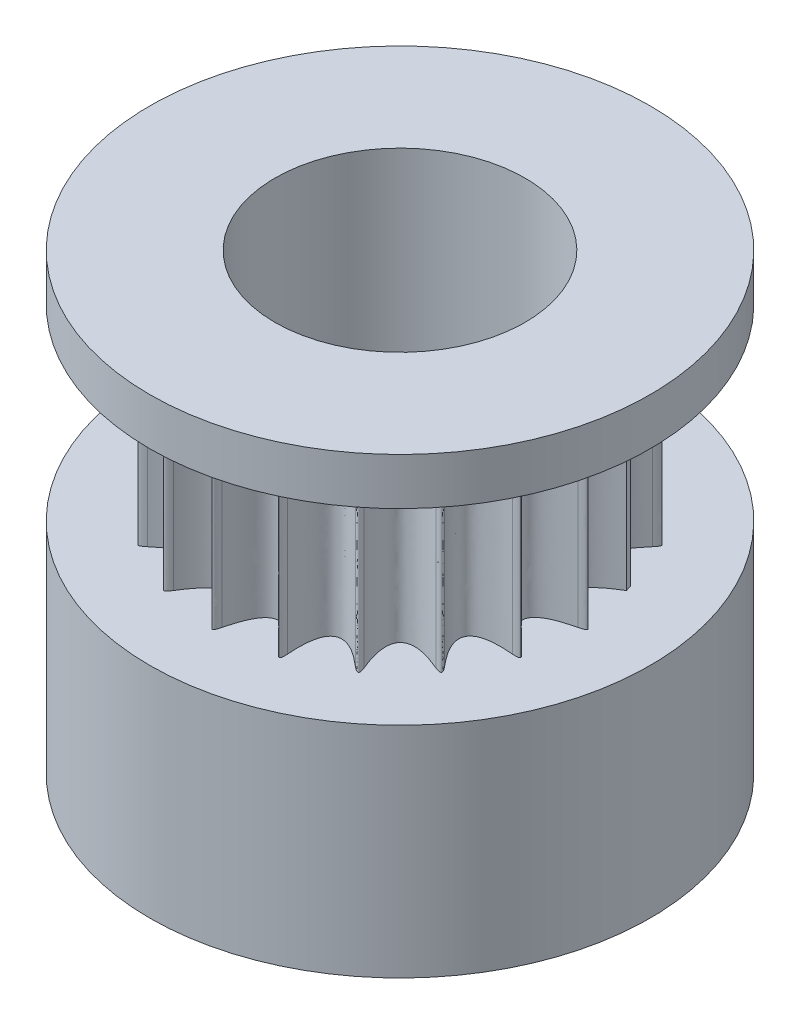
from build123d import *

# Parameters (mm, degrees)
SKETCH1_R           = 8
BOSS_EXTRUDE1_DEPTH = 7
BOSS_EXTRUDE2_DEPTH = 6
SKETCH3_R           = 8
BOSS_EXTRUDE3_DEPTH = 1.5
SKETCH4_R           = 4
CUT_EXTRUDE1_DEPTH  = 19.391574245


with BuildPart() as part:
    # Sketch1 → Boss-Extrude1 (new body)
    with BuildSketch(Plane(origin=(0, 0, 0), x_dir=(1, 0, 0), z_dir=(0, 1, 0))):
        with Locations(Location((0, 0, 0), (0, 0, 270))):
            Circle(SKETCH1_R)
    extrude(amount=BOSS_EXTRUDE1_DEPTH)

    # Sketch2 → Boss-Extrude2 (add)
    with BuildSketch(Plane(origin=(0, 7, 0), x_dir=(1, 0, 0), z_dir=(0, 1, 0))):
        with BuildLine():
            Line((5.547029494, 1.697192916), (5.516127795, 1.792298567))
            Line((5.516127795, 1.792298567), (5.485226095, 1.887404219))
            add(Edge.make_bspline(
                [(4.751077093, 3.328252764), (3.353389557, 1.729025513), (5.485226095, 1.887404219)],
                knots=[0, 0, 0, 1, 1, 1], degree=2))
            add(Edge.make_bspline(
                [(4.854101972, 3.526711505), (4.883491215, 3.486260648), (4.751077093, 3.328252764)],
                knots=[0.500000051, 0.500000051, 0.500000051, 1, 1, 1], degree=2))
            add(Edge.make_bspline(
                [(4.633520042, 3.490056163), (4.824712723, 3.567162371), (4.854101972, 3.526711505)],
                knots=[0, 0, 0, 0.500000051, 0.500000051, 0.500000051], degree=2))
            add(Edge.make_bspline(
                [(3.490056163, 4.633520042), (2.654964722, 2.680655343), (4.633520042, 3.490056163)],
                knots=[0, 0, 0, 1, 1, 1], degree=2))
            add(Edge.make_bspline(
                [(3.52671151, 4.854101969), (3.567162367, 4.824712713), (3.490056163, 4.633520042)],
                knots=[0.499999976, 0.499999976, 0.499999976, 1, 1, 1], degree=2))
            add(Edge.make_bspline(
                [(3.328252764, 4.751077093), (3.486260656, 4.883491222), (3.52671151, 4.854101969)],
                knots=[0, 0, 0, 0.499999976, 0.499999976, 0.499999976], degree=2))
            add(Edge.make_bspline(
                [(1.887404219, 5.485226095), (1.696653443, 3.369883951), (3.328252764, 4.751077093)],
                knots=[0, 0, 0, 1, 1, 1], degree=2))
            add(Edge.make_bspline(
                [(1.854101973, 5.706339096), (1.901654791, 5.690888234), (1.887404219, 5.485226095)],
                knots=[0.500000034, 0.500000034, 0.500000034, 1, 1, 1], degree=2))
            add(Edge.make_bspline(
                [(1.697192916, 5.547029494), (1.806549148, 5.721789959), (1.854101973, 5.706339096)],
                knots=[0, 0, 0, 0.500000034, 0.500000034, 0.500000034], degree=2))
            add(Edge.make_bspline(
                [(0.1, 5.8), (0.572261903, 3.729244838), (1.697192916, 5.547029494)],
                knots=[0, 0, 0, 1, 1, 1], degree=2))
            add(Edge.make_bspline(
                [(0, 6), (0.05, 6), (0.1, 5.8)],
                knots=[0.5, 0.5, 0.5, 1, 1, 1], degree=2))
            add(Edge.make_bspline(
                [(-0.1, 5.8), (-0.05, 6), (0, 6)],
                knots=[0, 0, 0, 0.5, 0.5, 0.5], degree=2))
            add(Edge.make_bspline(
                [(-1.697192916, 5.547029494), (-0.608146619, 3.723561257), (-0.1, 5.8)],
                knots=[0, 0, 0, 1, 1, 1], degree=2))
            add(Edge.make_bspline(
                [(-1.854101961, 5.7063391), (-1.806549134, 5.721789937), (-1.697192916, 5.547029494)],
                knots=[0.500000029, 0.500000029, 0.500000029, 1, 1, 1], degree=2))
            add(Edge.make_bspline(
                [(-1.887404219, 5.485226095), (-1.901654793, 5.69088826), (-1.854101961, 5.7063391)],
                knots=[0, 0, 0, 0.500000029, 0.500000029, 0.500000029], degree=2))
            add(Edge.make_bspline(
                [(-3.328252764, 4.751077093), (-1.729025513, 3.353389557), (-1.887404219, 5.485226095)],
                knots=[0, 0, 0, 1, 1, 1], degree=2))
            add(Edge.make_bspline(
                [(-3.526711504, 4.854101973), (-3.486260645, 4.883491213), (-3.328252764, 4.751077093)],
                knots=[0.50000006, 0.50000006, 0.50000006, 1, 1, 1], degree=2))
            add(Edge.make_bspline(
                [(-3.490056163, 4.633520042), (-3.567162373, 4.824712726), (-3.526711504, 4.854101973)],
                knots=[0, 0, 0, 0.50000006, 0.50000006, 0.50000006], degree=2))
            add(Edge.make_bspline(
                [(-4.633520042, 3.490056163), (-2.680655343, 2.654964722), (-3.490056163, 4.633520042)],
                knots=[0, 0, 0, 1, 1, 1], degree=2))
            add(Edge.make_bspline(
                [(-4.854101967, 3.526711513), (-4.824712705, 3.567162364), (-4.633520042, 3.490056163)],
                knots=[0.499999997, 0.499999997, 0.499999997, 1, 1, 1], degree=2))
            add(Edge.make_bspline(
                [(-4.751077093, 3.328252764), (-4.883491228, 3.486260663), (-4.854101967, 3.526711513)],
                knots=[0, 0, 0, 0.499999997, 0.499999997, 0.499999997], degree=2))
            add(Edge.make_bspline(
                [(-5.485226095, 1.887404219), (-3.369883951, 1.696653443), (-4.751077093, 3.328252764)],
                knots=[0, 0, 0, 1, 1, 1], degree=2))
            add(Edge.make_bspline(
                [(-5.706339094, 1.854101978), (-5.690888222, 1.90165479), (-5.485226095, 1.887404219)],
                knots=[0.500000062, 0.500000062, 0.500000062, 1, 1, 1], degree=2))
            add(Edge.make_bspline(
                [(-5.547029494, 1.697192916), (-5.721789969, 1.806549154), (-5.706339094, 1.854101978)],
                knots=[0, 0, 0, 0.500000062, 0.500000062, 0.500000062], degree=2))
            add(Edge.make_bspline(
                [(-5.8, 0.1), (-3.729244838, 0.572261903), (-5.547029494, 1.697192916)],
                knots=[0, 0, 0, 1, 1, 1], degree=2))
            add(Edge.make_bspline(
                [(-6, 0), (-6, 0.05), (-5.8, 0.1)],
                knots=[0.5, 0.5, 0.5, 1, 1, 1], degree=2))
            add(Edge.make_bspline(
                [(-5.8, -0.1), (-6, -0.05), (-6, 0)],
                knots=[0, 0, 0, 0.5, 0.5, 0.5], degree=2))
            add(Edge.make_bspline(
                [(-5.547029494, -1.697192916), (-3.723561257, -0.608146619), (-5.8, -0.1)],
                knots=[0, 0, 0, 1, 1, 1], degree=2))
            add(Edge.make_bspline(
                [(-5.706339097, -1.854101969), (-5.721789953, -1.806549144), (-5.547029494, -1.697192916)],
                knots=[0.499999986, 0.499999986, 0.499999986, 1, 1, 1], degree=2))
            add(Edge.make_bspline(
                [(-5.485226095, -1.887404219), (-5.690888242, -1.901654792), (-5.706339097, -1.854101969)],
                knots=[0, 0, 0, 0.499999986, 0.499999986, 0.499999986], degree=2))
            add(Edge.make_bspline(
                [(-4.751077093, -3.328252764), (-3.353389557, -1.729025513), (-5.485226095, -1.887404219)],
                knots=[0, 0, 0, 1, 1, 1], degree=2))
            add(Edge.make_bspline(
                [(-4.854101967, -3.526711513), (-4.883491228, -3.486260663), (-4.751077093, -3.328252764)],
                knots=[0.500000003, 0.500000003, 0.500000003, 1, 1, 1], degree=2))
            add(Edge.make_bspline(
                [(-4.633520042, -3.490056163), (-4.824712705, -3.567162364), (-4.854101967, -3.526711513)],
                knots=[0, 0, 0, 0.500000003, 0.500000003, 0.500000003], degree=2))
            add(Edge.make_bspline(
                [(-3.490056163, -4.633520042), (-2.654964722, -2.680655343), (-4.633520042, -3.490056163)],
                knots=[0, 0, 0, 1, 1, 1], degree=2))
            add(Edge.make_bspline(
                [(-3.526711519, -4.854101962), (-3.567162359, -4.824712691), (-3.490056163, -4.633520042)],
                knots=[0.500000032, 0.500000032, 0.500000032, 1, 1, 1], degree=2))
            add(Edge.make_bspline(
                [(-3.328252764, -4.751077093), (-3.486260674, -4.883491237), (-3.526711519, -4.854101962)],
                knots=[0, 0, 0, 0.500000032, 0.500000032, 0.500000032], degree=2))
            add(Edge.make_bspline(
                [(-1.887404219, -5.485226095), (-1.696653443, -3.369883951), (-3.328252764, -4.751077093)],
                knots=[0, 0, 0, 1, 1, 1], degree=2))
            add(Edge.make_bspline(
                [(-1.854101972, -5.706339096), (-1.901654791, -5.690888235), (-1.887404219, -5.485226095)],
                knots=[0.500000032, 0.500000032, 0.500000032, 1, 1, 1], degree=2))
            add(Edge.make_bspline(
                [(-1.697192916, -5.547029494), (-1.806549148, -5.721789959), (-1.854101972, -5.706339096)],
                knots=[0, 0, 0, 0.500000032, 0.500000032, 0.500000032], degree=2))
            add(Edge.make_bspline(
                [(-0.1, -5.8), (-0.572261903, -3.729244838), (-1.697192916, -5.547029494)],
                knots=[0, 0, 0, 1, 1, 1], degree=2))
            add(Edge.make_bspline(
                [(0, -6), (-0.05, -6), (-0.1, -5.8)],
                knots=[0.5, 0.5, 0.5, 1, 1, 1], degree=2))
            add(Edge.make_bspline(
                [(0.1, -5.8), (0.05, -6), (0, -6)],
                knots=[0, 0, 0, 0.5, 0.5, 0.5], degree=2))
            add(Edge.make_bspline(
                [(1.697192916, -5.547029494), (0.608146619, -3.723561257), (0.1, -5.8)],
                knots=[0, 0, 0, 1, 1, 1], degree=2))
            add(Edge.make_bspline(
                [(1.854101961, -5.7063391), (1.806549134, -5.721789937), (1.697192916, -5.547029494)],
                knots=[0.500000029, 0.500000029, 0.500000029, 1, 1, 1], degree=2))
            add(Edge.make_bspline(
                [(1.887404219, -5.485226095), (1.901654793, -5.69088826), (1.854101961, -5.7063391)],
                knots=[0, 0, 0, 0.500000029, 0.500000029, 0.500000029], degree=2))
            add(Edge.make_bspline(
                [(3.328252764, -4.751077093), (1.729025513, -3.353389557), (1.887404219, -5.485226095)],
                knots=[0, 0, 0, 1, 1, 1], degree=2))
            add(Edge.make_bspline(
                [(3.526711518, -4.854101963), (3.486260673, -4.883491236), (3.328252764, -4.751077093)],
                knots=[0.499999972, 0.499999972, 0.499999972, 1, 1, 1], degree=2))
            add(Edge.make_bspline(
                [(3.490056163, -4.633520042), (3.567162359, -4.824712693), (3.526711518, -4.854101963)],
                knots=[0, 0, 0, 0.499999972, 0.499999972, 0.499999972], degree=2))
            add(Edge.make_bspline(
                [(4.633520042, -3.490056163), (2.680655343, -2.654964722), (3.490056163, -4.633520042)],
                knots=[0, 0, 0, 1, 1, 1], degree=2))
            add(Edge.make_bspline(
                [(4.854101962, -3.526711519), (4.824712691, -3.567162358), (4.633520042, -3.490056163)],
                knots=[0.500000032, 0.500000032, 0.500000032, 1, 1, 1], degree=2))
            add(Edge.make_bspline(
                [(4.751077093, -3.328252764), (4.883491237, -3.486260674), (4.854101962, -3.526711519)],
                knots=[0, 0, 0, 0.500000032, 0.500000032, 0.500000032], degree=2))
            add(Edge.make_bspline(
                [(5.485226095, -1.887404219), (3.369883951, -1.696653443), (4.751077093, -3.328252764)],
                knots=[0, 0, 0, 1, 1, 1], degree=2))
            add(Edge.make_bspline(
                [(5.7063391, -1.854101961), (5.69088826, -1.901654793), (5.485226095, -1.887404219)],
                knots=[0.499999971, 0.499999971, 0.499999971, 1, 1, 1], degree=2))
            add(Edge.make_bspline(
                [(5.547029494, -1.697192916), (5.721789937, -1.806549134), (5.7063391, -1.854101961)],
                knots=[0, 0, 0, 0.499999971, 0.499999971, 0.499999971], degree=2))
            add(Edge.make_bspline(
                [(5.8, -0.1), (3.729244838, -0.572261903), (5.547029494, -1.697192916)],
                knots=[0, 0, 0, 1, 1, 1], degree=2))
            add(Edge.make_bspline(
                [(6, 0), (6, -0.05), (5.8, -0.1)],
                knots=[0.5, 0.5, 0.5, 1, 1, 1], degree=2))
            add(Edge.make_bspline(
                [(5.8, 0.1), (6, 0.05), (6, 0)],
                knots=[0, 0, 0, 0.5, 0.5, 0.5], degree=2))
            add(Edge.make_bspline(
                [(5.547029494, 1.697192916), (3.723561257, 0.608146619), (5.8, 0.1)],
                knots=[0, 0, 0, 1, 1, 1], degree=2))
        make_face()
    extrude(amount=BOSS_EXTRUDE2_DEPTH)

    # Sketch3 → Boss-Extrude3 (add)
    with BuildSketch(Plane(origin=(0, 13, 0), x_dir=(1, 0, 0), z_dir=(0, 1, 0))):
        with Locations(Location((0, 0, 0), (0, 0, 270))):
            Circle(SKETCH3_R)
    extrude(amount=BOSS_EXTRUDE3_DEPTH)

    # Sketch4 → Cut-Extrude1 (cut, through all)
    with BuildSketch(Plane(origin=(0, 14.5, 0), x_dir=(1, 0, 0), z_dir=(0, 1, 0))):
        with Locations(Location((0, 0, 0), (0, 0, 270))):
            Circle(SKETCH4_R)
    extrude(amount=-CUT_EXTRUDE1_DEPTH, mode=Mode.SUBTRACT)


solid = part.part
